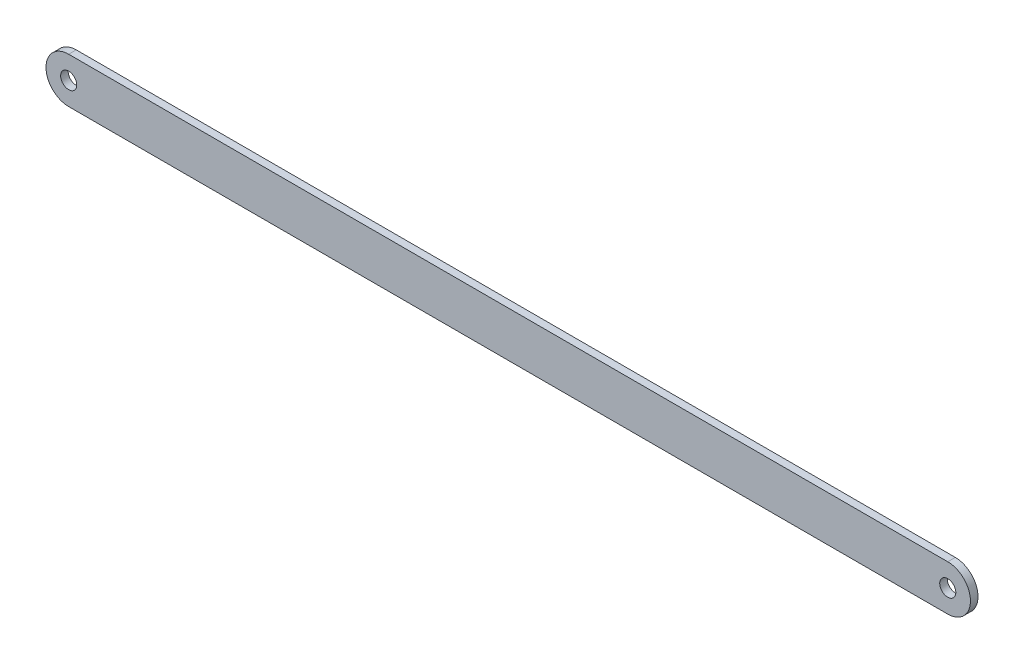
from build123d import *

# Parameters (mm, degrees)
BOSS_EXTRUDE1_DEPTH     = 1.5875
F_1_4_CLEARANCE_HOLE1_D = 6.7564


with BuildPart() as part:
    # Sketch2 → Boss-Extrude1 (new, symmetric)
    with BuildSketch(Plane.XY):
        with BuildLine():
            Line((184.587411543, -9.525), (-184.587411543, -9.525))
            ThreePointArc((-184.587411543, -9.525), (-194.112411543, 0), (-184.587411543, 9.525))
            Line((-184.587411543, 9.525), (184.587411543, 9.525))
            ThreePointArc((184.587411543, 9.525), (194.112411543, 0), (184.587411543, -9.525))
        make_face()
    extrude(amount=BOSS_EXTRUDE1_DEPTH, both=True)

    # 1/4 Clearance Hole1 (through all)
    with Locations(Plane.XY.offset(1.5875)):
        with Locations((-184.587411543, 0), (184.587411543, 0)):
            Hole(F_1_4_CLEARANCE_HOLE1_D / 2)


solid = part.part
